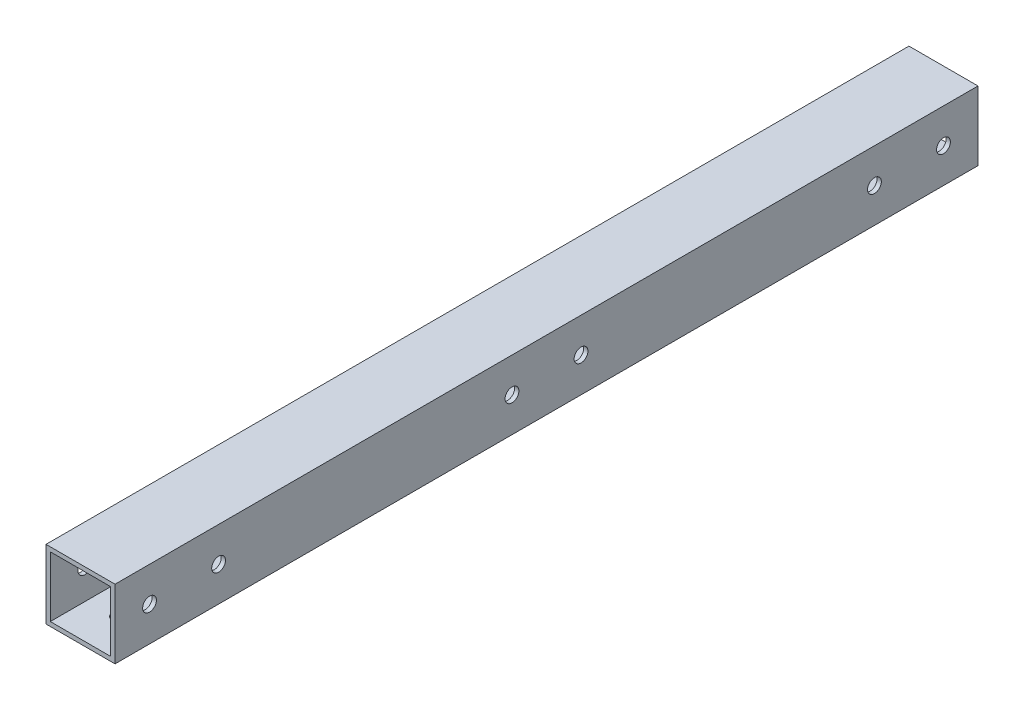
from build123d import *

# Parameters (mm, degrees)
SKETCH1_W           = 25.4
SKETCH1_H           = 25.4
SKETCH1_W_2         = 22.225
SKETCH1_H_2         = 22.225
BOSS_EXTRUDE1_DEPTH = 317.5
SKETCH4_R           = 2.54
CUT_EXTRUDE3_DEPTH  = 320.525538885
CUT_EXTRUDE4_REACH  = 321.526
SKETCH5_R           = 2.54


with BuildPart() as part:
    # Sketch1 → Boss-Extrude1 (new body)
    with BuildSketch(Plane.XY):
        with Locations((12.7, 12.7)):
            Rectangle(SKETCH1_W, SKETCH1_H)
        with Locations((12.7, 12.7)):
            Rectangle(SKETCH1_W_2, SKETCH1_H_2, mode=Mode.SUBTRACT)
    extrude(amount=BOSS_EXTRUDE1_DEPTH)

    # Sketch4 → Cut-Extrude3 (cut, through all)
    with BuildSketch(Plane(origin=(25.4, 0, 0), x_dir=(0, 0, -1), z_dir=(1, 0, 0))):
        with Locations((-304.8, 12.7)):
            Circle(SKETCH4_R)
        with Locations((-279.4, 12.7)):
            Circle(SKETCH4_R)
        with Locations(Location((-38.1, 12.7, 0), (0, 0, 180))):
            Circle(SKETCH4_R)
        with Locations(Location((-12.7, 12.7, 0), (0, 0, 180))):
            Circle(SKETCH4_R)
        with Locations((-171.45, 12.7)):
            Circle(SKETCH4_R)
        with Locations(Location((-146.05, 12.7, 0), (0, 0, 180))):
            Circle(SKETCH4_R)
    extrude(amount=-CUT_EXTRUDE3_DEPTH, mode=Mode.SUBTRACT)

    # Sketch5 → Cut-Extrude4 (cut, up to next)
    with BuildSketch(Plane.XZ, mode=Mode.PRIVATE) as cut_extrude4_sk1:
        with Locations(Location((12.7, 303.2125, 0), (0, 0, 270))):
            Circle(SKETCH5_R)
    cut_extrude4_tool1 = extrude(cut_extrude4_sk1.sketch, amount=-CUT_EXTRUDE4_REACH, mode=Mode.PRIVATE) & part.part
    # Sketch5 → Cut-Extrude4 (cut, up to next)
    with BuildSketch(Plane.XZ, mode=Mode.PRIVATE) as cut_extrude4_sk2:
        with Locations(Location((12.7, 14.2875, 0), (0, 0, 270))):
            Circle(SKETCH5_R)
    cut_extrude4_tool2 = extrude(cut_extrude4_sk2.sketch, amount=-CUT_EXTRUDE4_REACH, mode=Mode.PRIVATE) & part.part
    add(cut_extrude4_tool1.solids().sort_by_distance((12.7, 0, 303.2125))[0], mode=Mode.SUBTRACT)
    add(cut_extrude4_tool2.solids().sort_by_distance((12.7, 0, 14.2875))[0], mode=Mode.SUBTRACT)


solid = part.part
